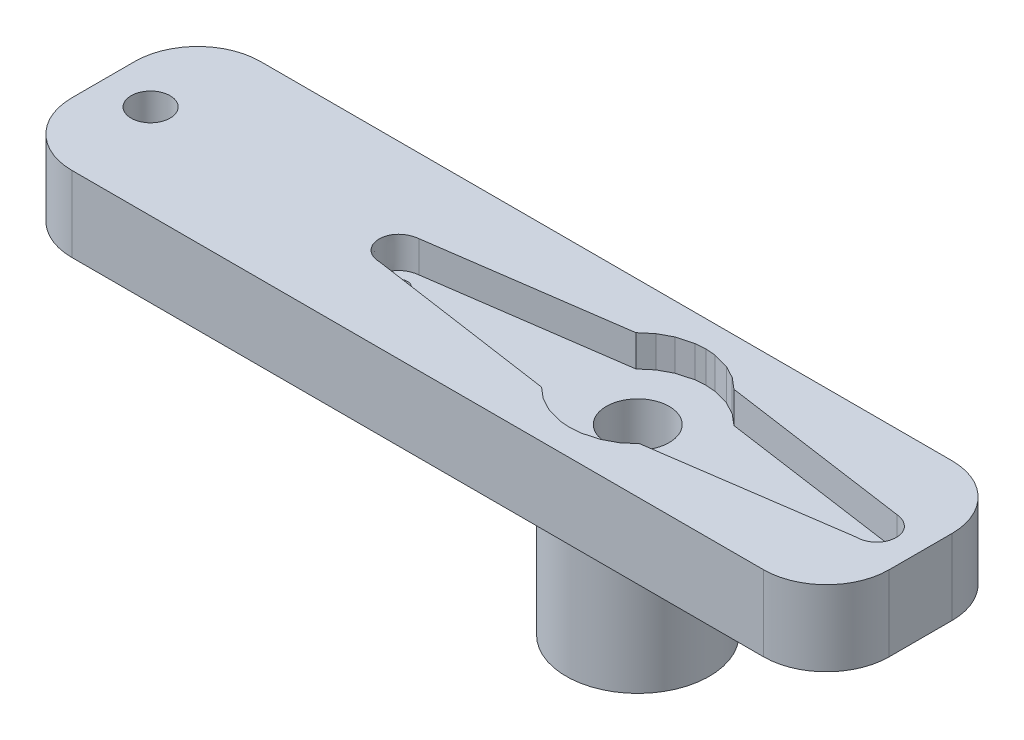
from build123d import *

# Parameters (mm, degrees)
ESQUISSE1_W             = 45
ESQUISSE1_H             = 15
BOSS_EXTRU_1_DEPTH      = 6
ESQUISSE2_R             = 2.5
ENL_V_MAT_EXTRU_1_DEPTH = 6
ESQUISSE4_R             = 0.7
ENL_V_MAT_EXTRU_2_DEPTH = 7
ENL_V_MAT_EXTRU_3_DEPTH = 2.5
ESQUISSE7_W             = 15
ESQUISSE7_H             = 6
BOSS_EXTRU_2_DEPTH      = 20
ESQUISSE8_R             = 1.55
ENL_V_MAT_EXTRU_4_DEPTH = 7.5
CONG_1_R                = 5
ESQUISSE9_R             = 5.693069504
ESQUISSE9_R_2           = 4.4
BOSS_EXTRU_3_DEPTH      = 11


with BuildPart() as part:
    # Esquisse1 → Boss.-Extru.1 (new body)
    with BuildSketch(Plane(origin=(0, 0, 0), x_dir=(1, 0, 0), z_dir=(0, 1, 0))):
        Rectangle(ESQUISSE1_W, ESQUISSE1_H)
    extrude(amount=BOSS_EXTRU_1_DEPTH)

    # Esquisse2 → Enlèv. mat.-Extru.1 (cut)
    with BuildSketch(Plane.XZ):
        with Locations(Location((0, 0, 0), (0, 0, 270))):
            Circle(ESQUISSE2_R)
    extrude(amount=-ENL_V_MAT_EXTRU_1_DEPTH, mode=Mode.SUBTRACT)

    # Esquisse4 → Enlèv. mat.-Extru.2 (cut)
    with BuildSketch(Plane.XZ):
        with Locations(Location((19, 0, 0), (0, 0, 270))):
            Circle(ESQUISSE4_R)
        with Locations(Location((-19, 0, 0), (0, 0, 270))):
            Circle(ESQUISSE4_R)
    extrude(amount=-ENL_V_MAT_EXTRU_2_DEPTH, mode=Mode.SUBTRACT)

    # Esquisse3 → Enlèv. mat.-Extru.3 (cut)
    with BuildSketch(Plane(origin=(0, 6, 0), x_dir=(1, 0, 0), z_dir=(0, 1, 0))):
        with BuildLine():
            Line((19, -1.561713939), (3.9, -3.75))
            Line((3.9, -3.75), (3.031885991, -4.483073583))
            Line((3.031885991, -4.483073583), (2.039673068, -5.012984659))
            Line((2.039673068, -5.012984659), (0.804642856, -5.351899783))
            Line((0.804642856, -5.351899783), (0, -5.41204965))
            Line((0, -5.41204965), (-0.804642856, -5.351899783))
            Line((-0.804642856, -5.351899783), (-2.039673068, -5.012984659))
            Line((-2.039673068, -5.012984659), (-3.031885991, -4.483073583))
            Line((-3.031885991, -4.483073583), (-3.9, -3.75))
            Line((-3.9, -3.75), (-19, -1.561713939))
            add(Edge.make_bspline(
                [(-19, -1.561713939), (-19.54064696, -1.574730153), (-20.339297961, -1.094989964), (-20.651707254, 0.047472401), (-20.293588536, 1.158800051), (-19.477708587, 1.555954085), (-19, 1.6)],
                knots=[0, 0, 0, 0, 0.329484693, 0.499358548, 0.699444054, 1, 1, 1, 1], degree=3))
            Line((-19, 1.6), (-3.9, 3.75))
            Line((-3.9, 3.75), (-3.031885991, 4.483073583))
            Line((-3.031885991, 4.483073583), (-2.039673068, 5.012984659))
            Line((-2.039673068, 5.012984659), (-0.804642856, 5.351899783))
            Line((-0.804642856, 5.351899783), (0, 5.41204965))
            Line((0, 5.41204965), (0.804642856, 5.351899783))
            Line((0.804642856, 5.351899783), (2.039673068, 5.012984659))
            Line((2.039673068, 5.012984659), (3.031885991, 4.483073583))
            Line((3.031885991, 4.483073583), (3.9, 3.75))
            Line((3.9, 3.75), (19, 1.6))
            add(Edge.make_bspline(
                [(19, -1.561713939), (19.54064696, -1.574730153), (20.339297961, -1.094989964), (20.651707254, 0.047472401), (20.293588536, 1.158800051), (19.477708587, 1.555954085), (19, 1.6)],
                knots=[0, 0, 0, 0, 0.329484693, 0.499358548, 0.699444054, 1, 1, 1, 1], degree=3))
        make_face()
    extrude(amount=-ENL_V_MAT_EXTRU_3_DEPTH, mode=Mode.SUBTRACT)

    # Esquisse7 → Boss.-Extru.2 (add)
    with BuildSketch(Plane.ZY.offset(22.5)):
        with Locations((0, 3)):
            Rectangle(ESQUISSE7_W, ESQUISSE7_H)
    extrude(amount=BOSS_EXTRU_2_DEPTH)

    # Esquisse8 → Enlèv. mat.-Extru.4 (cut)
    with BuildSketch(Plane.XZ):
        with Locations(Location((-38.739352064, 0, 0), (0, 0, 270))):
            Circle(ESQUISSE8_R)
    extrude(amount=-ENL_V_MAT_EXTRU_4_DEPTH, mode=Mode.SUBTRACT)

    # Congé1
    cong_1_edges = [part.edges().sort_by_distance(p)[0] for p in [
        (22.5, 3, 7.5),
        (22.5, 3, -7.5),
        (-42.5, 3, -7.5),
        (-42.5, 3, 7.5),
    ]]
    fillet(cong_1_edges, radius=CONG_1_R)

    # Esquisse9 → Boss.-Extru.3 (add)
    with BuildSketch(Plane.XZ):
        with Locations(Location((0, 0, 0), (0, 0, 270))):
            Circle(ESQUISSE9_R)
        with Locations(Location((0, 0, 0), (0, 0, 270))):
            Circle(ESQUISSE9_R_2, mode=Mode.SUBTRACT)
    extrude(amount=BOSS_EXTRU_3_DEPTH)


solid = part.part
